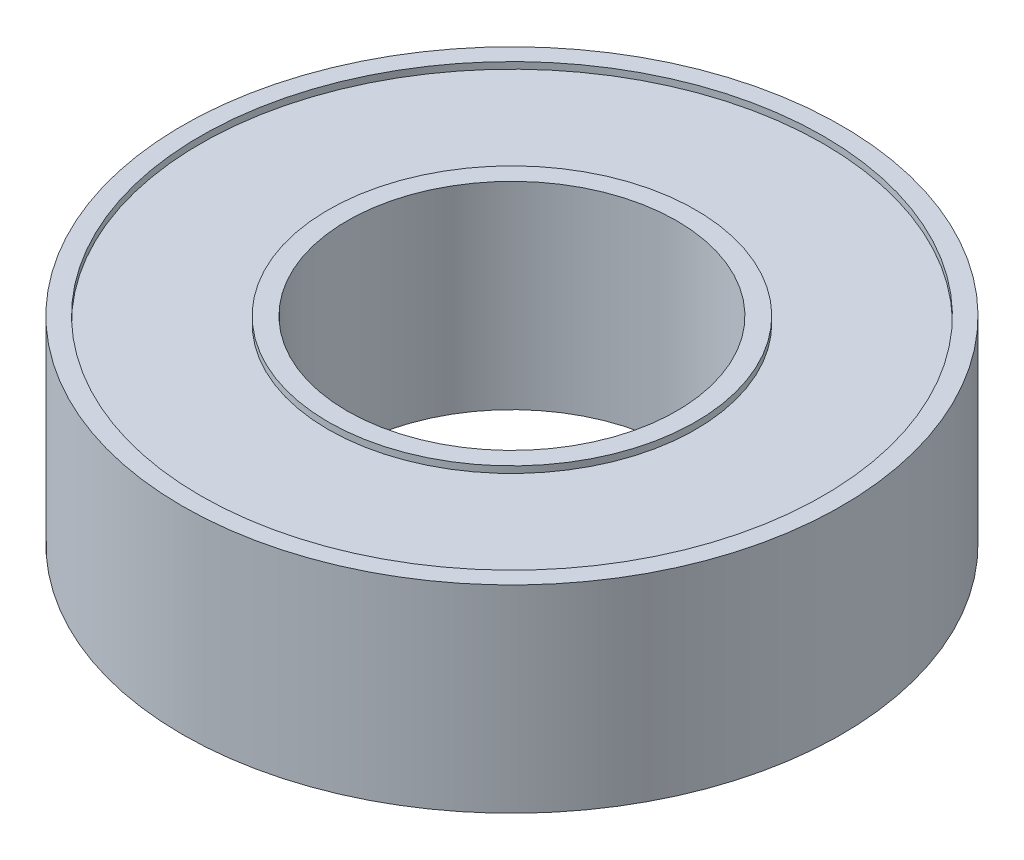
from build123d import *

# Parameters (mm, degrees)
SKETCH1_R           = 5
SKETCH1_R_2         = 2.5
BOSS_EXTRUDE1_DEPTH = 3
SKETCH2_R           = 4.725189579
SKETCH2_R_2         = 2.787282072
CUT_EXTRUDE1_DEPTH  = 0.1
CUT_EXTRUDE2_START  = -0.1
SKETCH3_R           = 4.725189579
SKETCH3_R_2         = 2.787282072
CUT_EXTRUDE2_DEPTH  = 0.1


with BuildPart() as part:
    # Sketch1 → Boss-Extrude1 (new body)
    with BuildSketch(Plane(origin=(0, 0, 0), x_dir=(1, 0, 0), z_dir=(0, 1, 0))):
        with Locations(Location((0, 0, 0), (0, 0, 270))):
            Circle(SKETCH1_R)
        with Locations(Location((0, 0, 0), (0, 0, 270))):
            Circle(SKETCH1_R_2, mode=Mode.SUBTRACT)
    extrude(amount=BOSS_EXTRUDE1_DEPTH)

    # Sketch2 → Cut-Extrude1 (cut)
    with BuildSketch(Plane.XZ):
        with Locations(Location((0, 0, 0), (0, 0, 270))):
            Circle(SKETCH2_R)
        with Locations(Location((0, 0, 0), (0, 0, 270))):
            Circle(SKETCH2_R_2, mode=Mode.SUBTRACT)
    extrude(amount=-CUT_EXTRUDE1_DEPTH, mode=Mode.SUBTRACT)

    # Sketch3 → Cut-Extrude2 (cut)
    with BuildSketch(Plane(origin=(0, 3, 0), x_dir=(1, 0, 0), z_dir=(0, 1, 0)).offset(CUT_EXTRUDE2_START)):
        with Locations(Location((0, 0, 0), (0, 0, 90))):
            Circle(SKETCH3_R)
        with Locations(Location((0, 0, 0), (0, 0, 90))):
            Circle(SKETCH3_R_2, mode=Mode.SUBTRACT)
    extrude(amount=CUT_EXTRUDE2_DEPTH, mode=Mode.SUBTRACT)


solid = part.part
